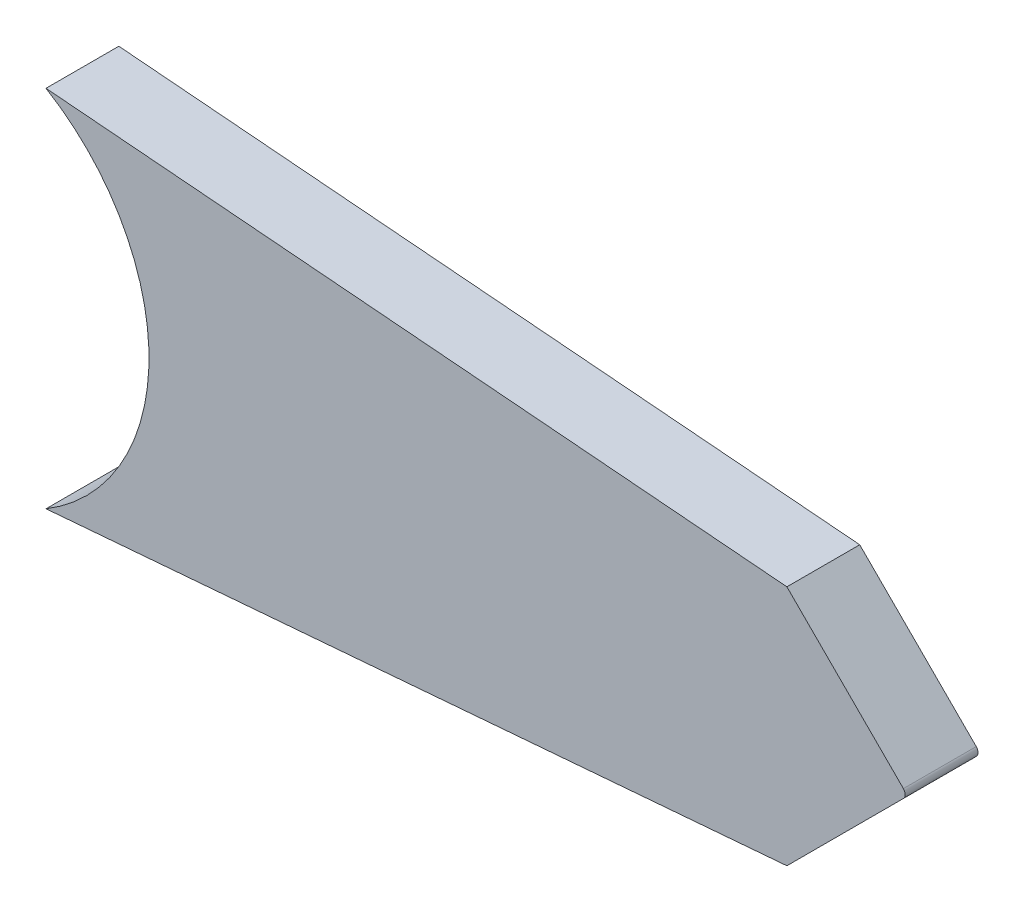
from build123d import *

# Parameters (mm, degrees)
BOSS_EXTRUDE1_DEPTH = 6
FILLET1_R           = 1


with BuildPart() as part:
    # Sketch1 → Boss-Extrude1 (new, symmetric)
    with BuildSketch(Plane.XY):
        with BuildLine():
            Line((51.083153784, -19.901846216), (-70.987243623, -30))
            ThreePointArc((-70.987243623, -30), (-54.015, 0), (-70.987243623, 30))
            Line((-70.987243623, 30), (51.083153784, 19.901846216))
            Line((51.083153784, 19.901846216), (70.985, 0))
            Line((70.985, 0), (51.083153784, -19.901846216))
        make_face()
    extrude(amount=BOSS_EXTRUDE1_DEPTH, both=True)

    # Fillet1
    fillet1_edges = [part.edges().sort_by_distance(p)[0] for p in [
        (70.985, 0, 0),
    ]]
    fillet(fillet1_edges, radius=FILLET1_R)


solid = part.part
